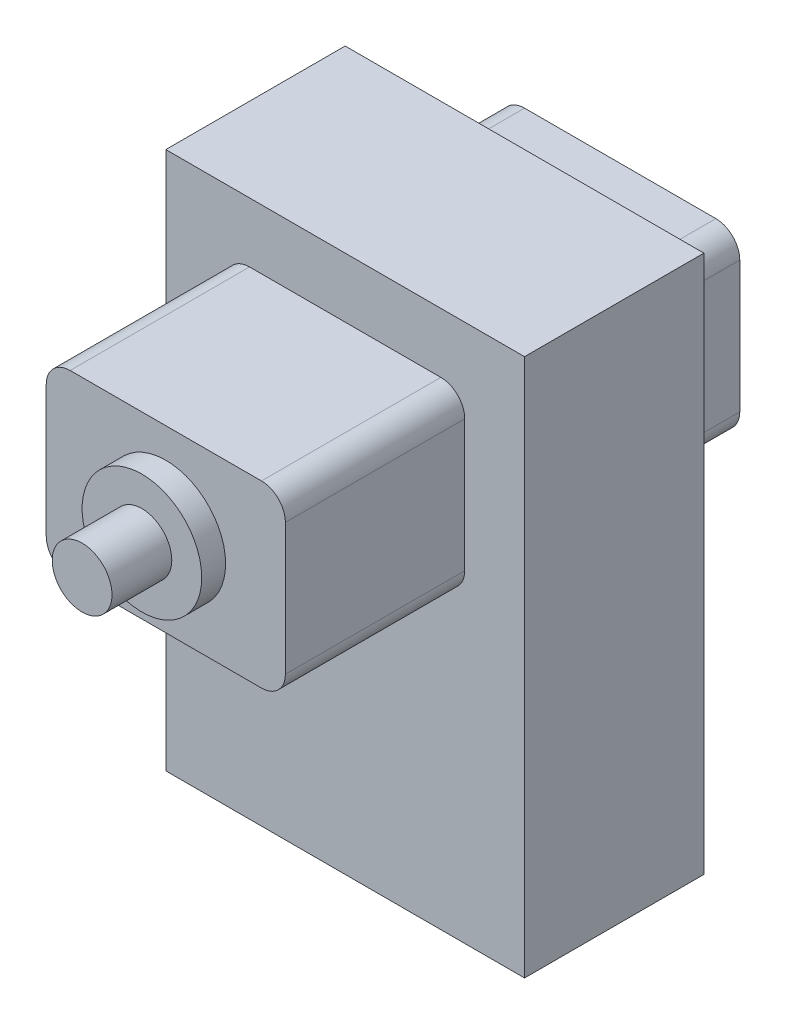
from build123d import *

# Parameters (mm, degrees)
SKETCH3_W           = 30
SKETCH3_H           = 45
BOSS_EXTRUDE1_DEPTH = 15
SKETCH4_W           = 20
SKETCH4_H           = 15
BOSS_EXTRUDE2_DEPTH = 15
SKETCH5_W           = 20
SKETCH5_H           = 15
BOSS_EXTRUDE3_DEPTH = 8
FILLET1_R           = 2
SKETCH6_R           = 5
BOSS_EXTRUDE4_DEPTH = 2
SKETCH7_R           = 2.5
BOSS_EXTRUDE5_DEPTH = 5


with BuildPart() as part:
    # Sketch3 → Boss-Extrude1 (new body)
    with BuildSketch(Plane.XY):
        with Locations((-15, 22.5)):
            Rectangle(SKETCH3_W, SKETCH3_H)
    extrude(amount=BOSS_EXTRUDE1_DEPTH)

    # Sketch4 → Boss-Extrude2 (add)
    with BuildSketch(Plane.XY.offset(15)):
        with Locations((-15, 32.5)):
            Rectangle(SKETCH4_W, SKETCH4_H)
    extrude(amount=BOSS_EXTRUDE2_DEPTH)

    # Sketch5 → Boss-Extrude3 (add)
    with BuildSketch(Plane(origin=(0, 0, 0), x_dir=(-1, 0, 0), z_dir=(0, 0, -1))):
        with Locations((15, 32.5)):
            Rectangle(SKETCH5_W, SKETCH5_H)
    extrude(amount=BOSS_EXTRUDE3_DEPTH)

    # Fillet1
    fillet1_edges = [part.edges().sort_by_distance(p)[0] for p in [
        (-25, 40, 22.5),
        (-25, 25, 22.5),
        (-5, 25, 22.5),
        (-5, 40, 22.5),
        (-5, 40, -4),
        (-5, 25, -4),
        (-25, 25, -4),
        (-25, 40, -4),
    ]]
    fillet(fillet1_edges, radius=FILLET1_R)

    # Sketch6 → Boss-Extrude4 (add)
    with BuildSketch(Plane.XY.offset(30)):
        with Locations((-15, 32.5)):
            Circle(SKETCH6_R)
    extrude(amount=BOSS_EXTRUDE4_DEPTH)

    # Sketch7 → Boss-Extrude5 (add)
    with BuildSketch(Plane.XY.offset(32)):
        with Locations((-15, 32.5)):
            Circle(SKETCH7_R)
    extrude(amount=BOSS_EXTRUDE5_DEPTH)


solid = part.part
